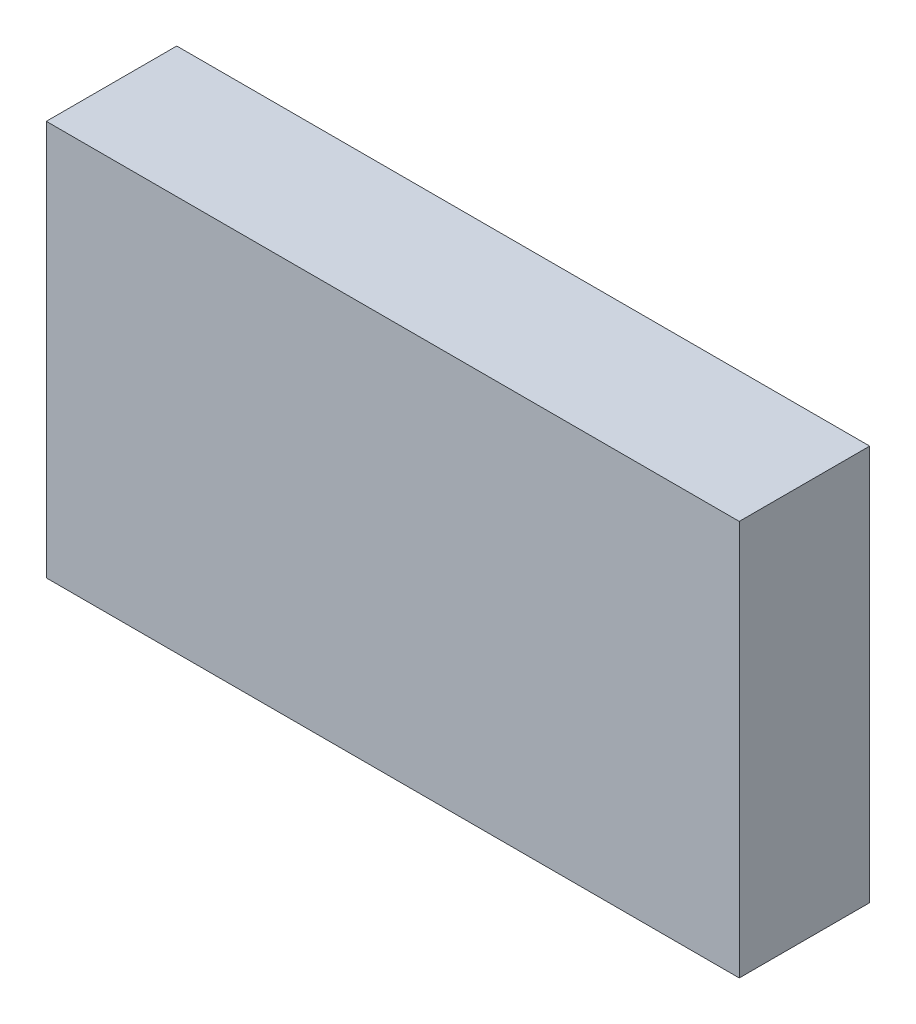
from build123d import *

# Parameters (mm, degrees)
SKETCH1_W           = 106.249419864
SKETCH1_H           = 60.631462422
BOSS_EXTRUDE1_DEPTH = 20


with BuildPart() as part:
    # Sketch1 → Boss-Extrude1 (new body)
    with BuildSketch(Plane.XY):
        with Locations((-1.443606248, 11.69321061)):
            Rectangle(SKETCH1_W, SKETCH1_H)
    extrude(amount=BOSS_EXTRUDE1_DEPTH)


solid = part.part
